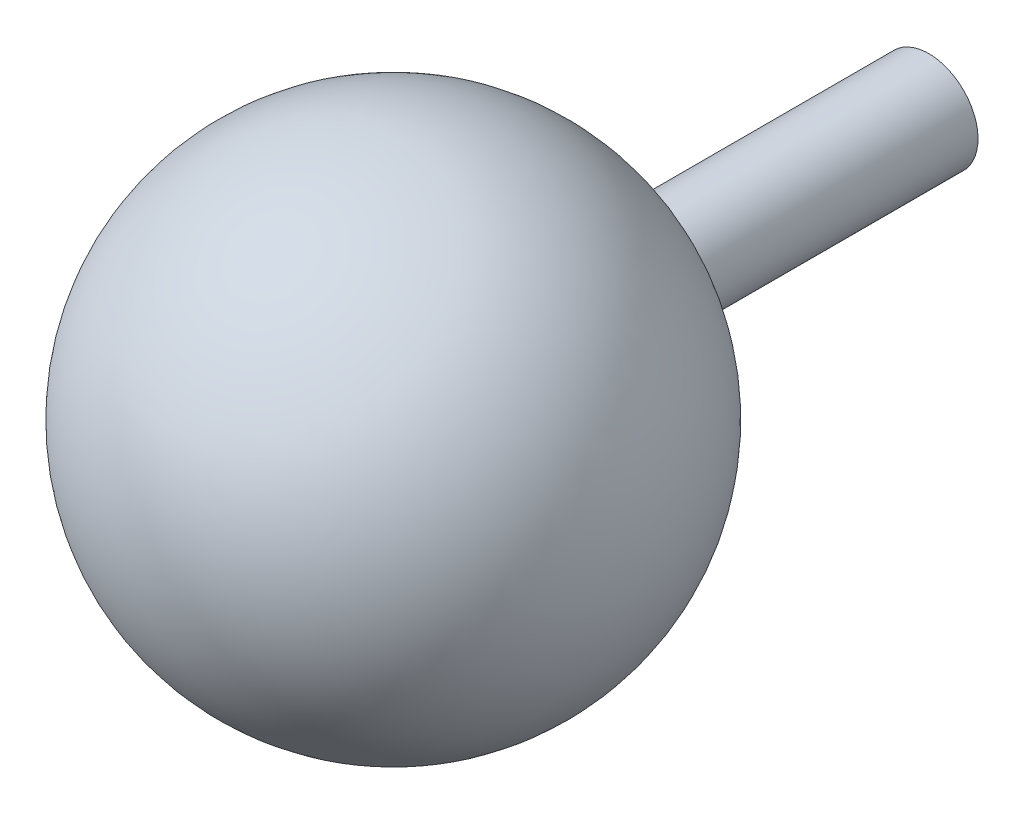
from build123d import *
from build123d.topology import SkipClean

# Parameters (mm, degrees)
SKETCH_2_R          = 2.273545296
CUT_EXTRUDE_1_DEPTH = 10
SKETCH_3_W          = 6
SKETCH_3_H          = 1


with BuildPart() as part:
    # 草图1 → 旋转2 (revolve)
    with BuildSketch(Plane.XY):
        with BuildLine():
            ThreePointArc((0, -5), (5, 0), (0, 5))
            Line((0, 5), (0, 4.9))
            ThreePointArc((0, 4.9), (4.9, 0), (0, -4.9))
            Line((0, -4.9), (0, -5))
        make_face()
    revolve(axis=Axis((0, 5, 0), (0, -1, 0)))

    # 草图2 → 切除-拉伸1 (cut)
    with BuildSketch(Plane(origin=(0, 0, 0), x_dir=(1, 0, 0), z_dir=(0, 1, 0))):
        with Locations(Location((0, 0, 0), (0, 0, 270))):
            Circle(SKETCH_2_R)
    extrude(amount=-CUT_EXTRUDE_1_DEPTH, mode=Mode.SUBTRACT)


with BuildPart() as body_2:
    # 草图3 → 旋转4 (revolve)
    with BuildSketch(Plane(origin=(0, 0, 0), x_dir=(0, 0, -1), z_dir=(1, 0, 0))):
        with Locations((7.898979486, -0.5)):
            Rectangle(SKETCH_3_W, SKETCH_3_H)
    revolve(axis=Axis((0, 0, 0.898979486), (0, 0, -1)))


with BuildPart() as body_3:
    # 草图4 → 旋转6 (revolve)
    with SkipClean():  # the faces are left unmerged after this step: merging them gives an invalid solid
        with BuildSketch(Plane(origin=(0, 0, 0), x_dir=(0, 0, -1), z_dir=(1, 0, 0))):
            with BuildLine():
                ThreePointArc((0.432732289, -4.453200174), (0.305987936, -4.147212237), (0, -4.020467884))
                Line((0, -4.020467884), (0, -4.885932463))
                ThreePointArc((0, -4.885932463), (0.305987936, -4.75918811), (0.432732289, -4.453200174))
            make_face()
            with BuildLine():
                Line((0, -4.885932463), (0, -4.020467884))
                ThreePointArc((0, -4.020467884), (-0.432732289, -4.453200174), (0, -4.885932463))
            make_face()
        revolve(axis=Axis((0, -4.020467884, 0), (0, -1, 0)))


solid = Compound([part.part, body_2.part, body_3.part])
